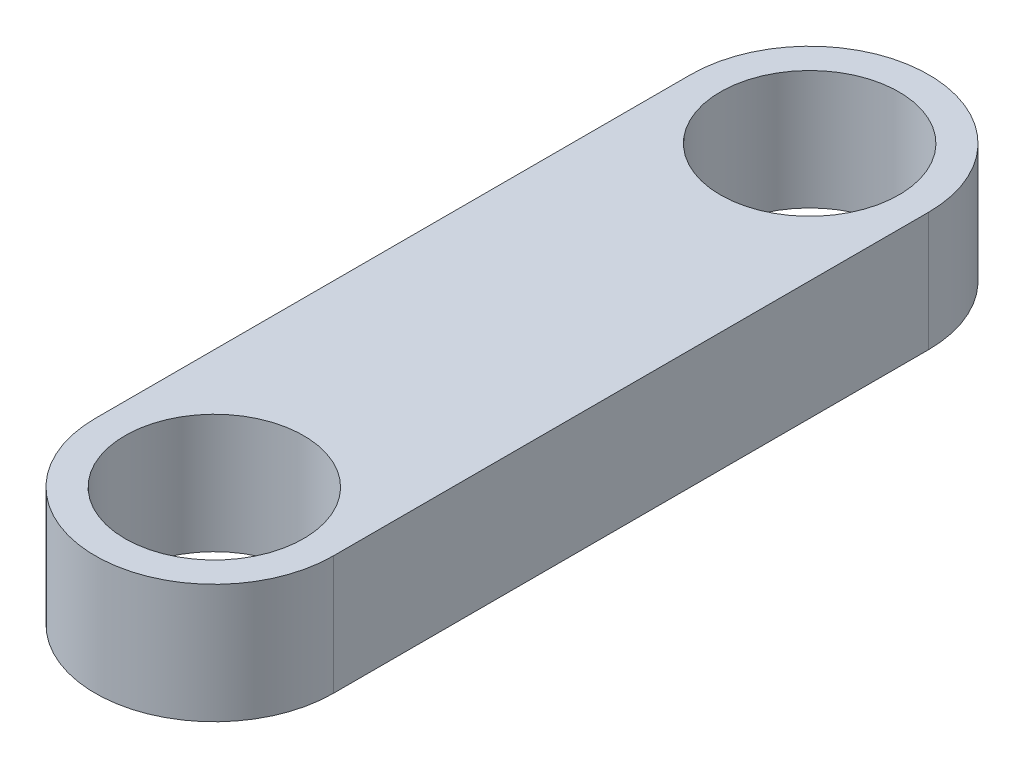
from build123d import *

# Parameters (mm, degrees)
BOSS_EXTRUDE1_DEPTH = 2


with BuildPart() as part:
    # Sketch1 → Boss-Extrude1 (new body)
    with BuildSketch(Plane(origin=(0, 0, 0), x_dir=(1, 0, 0), z_dir=(0, 1, 0))):
        with BuildLine():
            ThreePointArc((-2, -5), (0, -3), (2, -5))
            Line((2, -5), (2, 5))
            ThreePointArc((2, 5), (0, 3), (-2, 5))
            Line((-2, 5), (-2, -5))
        make_face()
        with BuildLine():
            ThreePointArc((-2, -5), (0, -7), (2, -5))
            Line((2, -5), (1.5, -5))
            ThreePointArc((1.5, -5), (0, -6.5), (-1.5, -5))
            Line((-1.5, -5), (-2, -5))
        make_face()
        with BuildLine():
            Line((1.5, -5), (2, -5))
            ThreePointArc((2, -5), (0, -3), (-2, -5))
            Line((-2, -5), (-1.5, -5))
            ThreePointArc((-1.5, -5), (0, -3.5), (1.5, -5))
        make_face()
        with BuildLine():
            ThreePointArc((-2, 5), (0, 3), (2, 5))
            Line((2, 5), (1.5, 5))
            ThreePointArc((1.5, 5), (0, 3.5), (-1.5, 5))
            Line((-1.5, 5), (-2, 5))
        make_face()
        with BuildLine():
            Line((1.5, 5), (2, 5))
            ThreePointArc((2, 5), (0, 7), (-2, 5))
            Line((-2, 5), (-1.5, 5))
            ThreePointArc((-1.5, 5), (0, 6.5), (1.5, 5))
        make_face()
    extrude(amount=BOSS_EXTRUDE1_DEPTH)


solid = part.part
